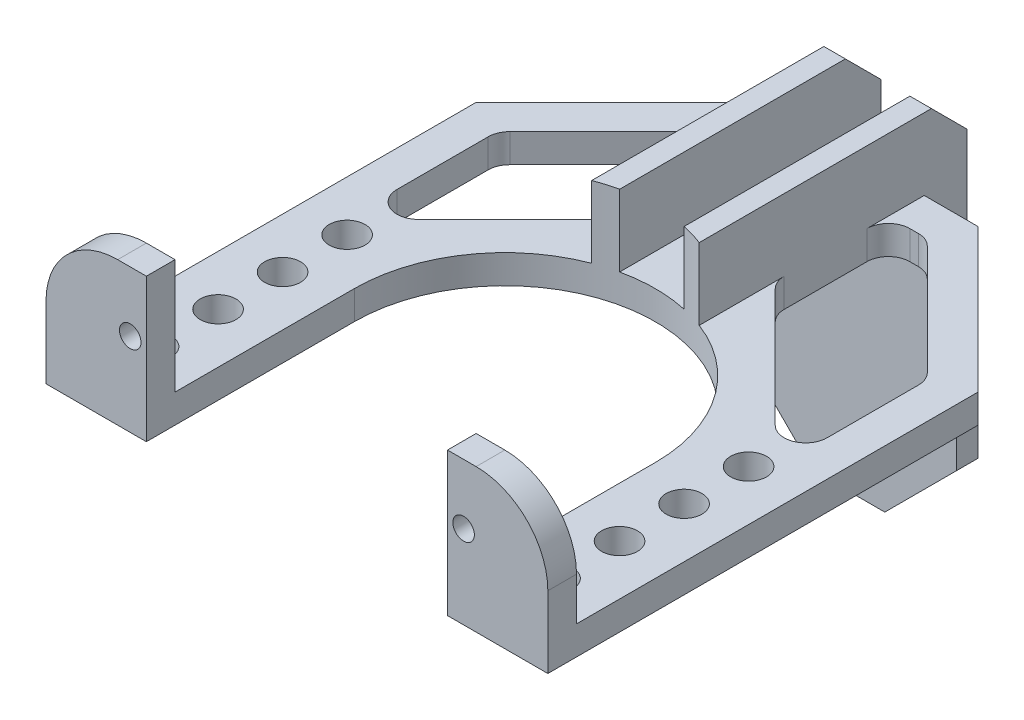
from build123d import *

# Parameters (mm, degrees)
SKETCH_1_W          = 70
SKETCH_1_H          = 80
EXTRUDE_1_DEPTH     = 4
SKETCH_2_W          = 70
SKETCH_2_H          = 4
EXTRUDE_2_DEPTH     = 16
CUT_EXTRUDE_1_DEPTH = 109.166538264
CHAMFER_1_SIZE      = 20
SKETCH_8_W          = 30
SKETCH_8_H          = 3
EXTRUDE_4_DEPTH     = 34
EXTRUDE_START       = 10
EXTRUDE_6_DEPTH     = 10
SKETCH_11_W         = 9
SKETCH_11_H         = 37.243398564
CUT_EXTRUDE_2_DEPTH = 10
CHAMFER_2_SIZE      = 3
SKETCH_12_W         = 3
SKETCH_12_H         = 48
EXTRUDE_7_DEPTH     = 6
CHAMFER_3_SIZE      = 5
SKETCH_13_W         = 9
SKETCH_13_H         = 3
EXTRUDE_8_DEPTH     = 6
CHAMFER_4_SIZE      = 10
CUT_EXTRUDE_3_DEPTH = 4
FILLET_3_R          = 3
SKETCH_15_R         = 2.5
CUT_EXTRUDE_4_DEPTH = 4
FILLET_4_R          = 10
SKETCH_16_R         = 1.5
CUT_EXTRUDE_5_DEPTH = 4


with BuildPart() as part:
    # 草图1 → 凸台-拉伸1 (new body)
    with BuildSketch(Plane(origin=(0, 0, 0), x_dir=(1, 0, 0), z_dir=(0, 1, 0))):
        with Locations((35, 40)):
            Rectangle(SKETCH_1_W, SKETCH_1_H)
    extrude(amount=EXTRUDE_1_DEPTH)

    # 草图2 → 凸台-拉伸2 (add)
    with BuildSketch(Plane(origin=(0, 4, 0), x_dir=(1, 0, 0), z_dir=(0, 1, 0))):
        with Locations((35, 2)):
            Rectangle(SKETCH_2_W, SKETCH_2_H)
    extrude(amount=EXTRUDE_2_DEPTH)

    # 草图4 → 切除-拉伸1 (cut, through all)
    with BuildSketch(Plane(origin=(0, 20, 0), x_dir=(1, 0, 0), z_dir=(0, 1, 0))):
        with BuildLine():
            Line((14, 29), (14, 0))
            Line((14, 0), (56, 0))
            Line((56, 0), (56, 29))
            ThreePointArc((56, 29), (35, 50), (14, 29))
        make_face()
    extrude(amount=-CUT_EXTRUDE_1_DEPTH, mode=Mode.SUBTRACT)

    # 倒角1
    chamfer_1_edges = [part.edges().sort_by_distance(p)[0] for p in [
        (0, 2, -80),
        (70, 2, -80),
    ]]
    chamfer(chamfer_1_edges, length=CHAMFER_1_SIZE)

    # 草图8 → 凸台-拉伸4 (add)
    with BuildSketch(Plane.XZ):
        with Locations((35, -78.5)):
            Rectangle(SKETCH_8_W, SKETCH_8_H)
    extrude(amount=EXTRUDE_4_DEPTH)

    # 草图10 → 凸台-拉伸6 (add)
    with BuildSketch(Plane(origin=(0, 4, 0), x_dir=(1, 0, 0), z_dir=(0, 1, 0)).offset(EXTRUDE_START)):
        with BuildLine():
            Line((42.5, 48.615045246), (42.5, 80))
            Line((42.5, 80), (27.5, 80))
            Line((27.5, 80), (27.5, 48.615045246))
            ThreePointArc((27.5, 48.615045246), (35, 50), (42.5, 48.615045246))
        make_face()
    extrude(amount=-EXTRUDE_6_DEPTH)

    # 草图11 → 切除-拉伸2 (cut)
    with BuildSketch(Plane(origin=(0, 14, 0), x_dir=(1, 0, 0), z_dir=(0, 1, 0))):
        with Locations((35, 61.378300718)):
            Rectangle(SKETCH_11_W, SKETCH_11_H)
    extrude(amount=-CUT_EXTRUDE_2_DEPTH, mode=Mode.SUBTRACT)

    # 倒角2
    chamfer_2_edges = [part.edges().sort_by_distance(p)[0] for p in [
        (35, 4, -80),
    ]]
    chamfer(chamfer_2_edges, length=CHAMFER_2_SIZE)

    # 草图12 → 凸台-拉伸7 (add)
    with BuildSketch(Plane(origin=(0, 0, -80), x_dir=(-1, 0, 0), z_dir=(0, 0, -1))):
        with Locations((-41, -10)):
            Rectangle(SKETCH_12_W, SKETCH_12_H)
        with Locations((-29, -10)):
            Rectangle(SKETCH_12_W, SKETCH_12_H)
    extrude(amount=EXTRUDE_7_DEPTH)

    # 倒角3
    chamfer_3_edges = [part.edges().sort_by_distance(p)[0] for p in [
        (41, 14, -86),
        (29, 14, -86),
    ]]
    chamfer(chamfer_3_edges, length=CHAMFER_3_SIZE)

    # 草图13 → 凸台-拉伸8 (add)
    with BuildSketch(Plane(origin=(0, 0, -80), x_dir=(-1, 0, 0), z_dir=(0, 0, -1))):
        with Locations((-35, -32.5)):
            Rectangle(SKETCH_13_W, SKETCH_13_H)
    extrude(amount=EXTRUDE_8_DEPTH)

    # 倒角4
    chamfer_4_edges = [part.edges().sort_by_distance(p)[0] for p in [
        (50, -34, -78.5),
        (20, -34, -78.5),
    ]]
    chamfer(chamfer_4_edges, length=CHAMFER_4_SIZE)

    # 草图14 → 切除-拉伸3 (cut)
    with BuildSketch(Plane(origin=(0, 4, 0), x_dir=(1, 0, 0), z_dir=(0, 1, 0))):
        Polygon((22.071067812, 75), (5, 57.928932188), (5, 36.715728753), (27.5, 59.215728753), (27.5, 75), align=None)
        Polygon((47.928932188, 75), (42.5, 75), (42.5, 59.215728753), (65, 36.715728753), (65, 57.928932188), align=None)
    extrude(amount=-CUT_EXTRUDE_3_DEPTH, mode=Mode.SUBTRACT)

    # 圆角3
    fillet_3_edges = [part.edges().sort_by_distance(p)[0] for p in [
        (47.928932188, 2, -75),
        (65, 2, -57.928932188),
        (65, 2, -36.715728753),
        (42.5, 2, -59.215728753),
        (42.5, 2, -75),
        (5, 2, -36.715728753),
        (5, 2, -57.928932188),
        (22.071067812, 2, -75),
        (27.5, 2, -75),
        (27.5, 2, -59.215728753),
    ]]
    fillet(fillet_3_edges, radius=FILLET_3_R)

    # 草图15 → 切除-拉伸4 (cut)
    with BuildSketch(Plane(origin=(0, 4, 0), x_dir=(1, 0, 0), z_dir=(0, 1, 0))):
        with Locations(Location((7, 8, 0), (0, 0, 270))):
            Circle(SKETCH_15_R)
        with Locations(Location((7, 17, 0), (0, 0, 270))):
            Circle(SKETCH_15_R)
        with Locations(Location((7, 26, 0), (0, 0, 270))):
            Circle(SKETCH_15_R)
        with Locations(Location((7, 35, 0), (0, 0, 270))):
            Circle(SKETCH_15_R)
        with Locations(Location((63, 35, 0), (0, 0, 90))):
            Circle(SKETCH_15_R)
        with Locations(Location((63, 26, 0), (0, 0, 90))):
            Circle(SKETCH_15_R)
        with Locations(Location((63, 17, 0), (0, 0, 90))):
            Circle(SKETCH_15_R)
        with Locations(Location((63, 8, 0), (0, 0, 90))):
            Circle(SKETCH_15_R)
    extrude(amount=-CUT_EXTRUDE_4_DEPTH, mode=Mode.SUBTRACT)

    # 圆角4
    fillet_4_edges = [part.edges().sort_by_distance(p)[0] for p in [
        (0, 20, -2),
        (70, 20, -2),
    ]]
    fillet(fillet_4_edges, radius=FILLET_4_R)

    # 草图16 → 切除-拉伸5 (cut)
    with BuildSketch(Plane(origin=(-162.95666402, 61.923916545, -4), x_dir=(-0.1273989198368121, 0.9918515590673908, 0), z_dir=(0, 0, -1))):
        with Locations(Location((-72.151278538, 166.87443555, 0), (0, 0, 277.319311568))):
            Circle(SKETCH_16_R)
        with Locations(Location((-78.075328311, 212.995533047, 0), (0, 0, 277.319311568))):
            Circle(SKETCH_16_R)
    extrude(amount=-CUT_EXTRUDE_5_DEPTH, mode=Mode.SUBTRACT)


solid = part.part
